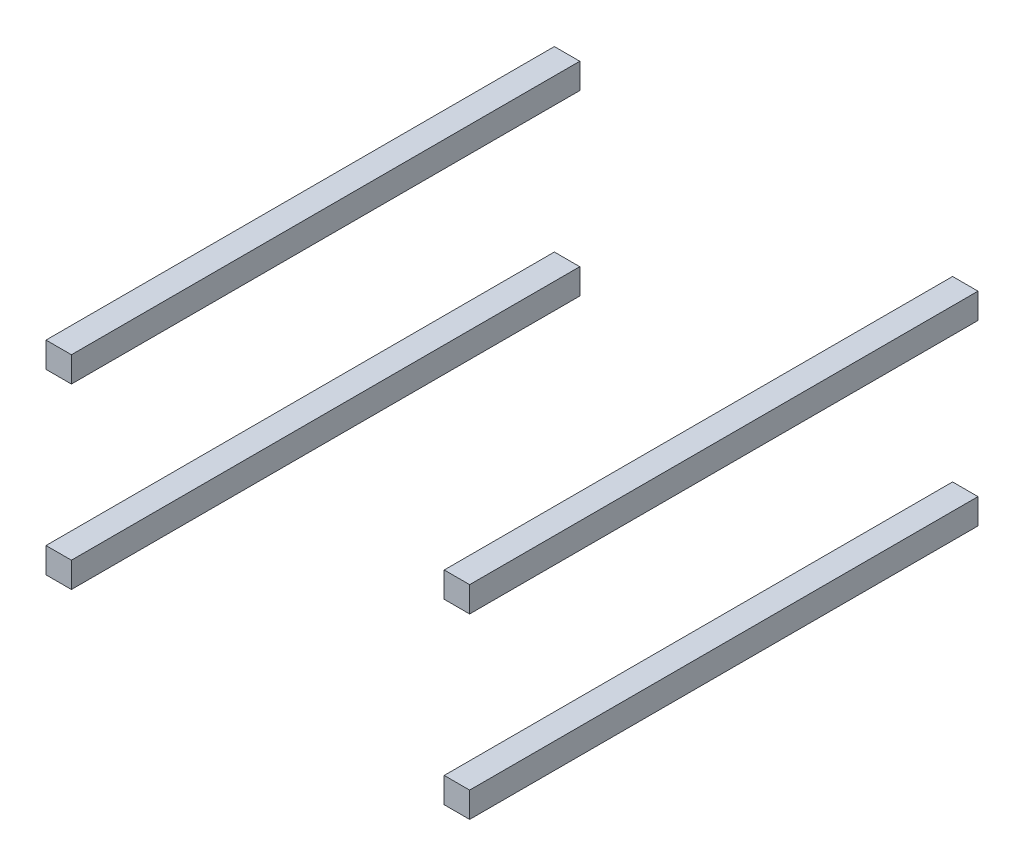
from build123d import *

# Parameters (mm, degrees)
SKETCH_1_W        = 30
SKETCH_1_H        = 30
EXTRUDE_1_DEPTH   = 600
EXTRUDE_1_2_DEPTH = 600
EXTRUDE_1_3_DEPTH = 600
EXTRUDE_1_4_DEPTH = 600


with BuildPart() as part:
    # 草图1 → 凸台-拉伸1 (new body)
    with BuildSketch(Plane.XY):
        with Locations((-432.698412698, 30.58079164)):
            Rectangle(SKETCH_1_W, SKETCH_1_H)
    extrude(amount=EXTRUDE_1_DEPTH)


with BuildPart() as body_2:
    # 草图1 → Extrude 1 2 (new body)
    with BuildSketch(Plane.XY):
        with Locations((37.301587302, 30.58079164)):
            Rectangle(SKETCH_1_W, SKETCH_1_H)
    extrude(amount=EXTRUDE_1_2_DEPTH)


with BuildPart() as body_3:
    # 草图1 → Extrude 1 3 (new body)
    with BuildSketch(Plane.XY):
        with Locations((-432.698412698, -179.41920836)):
            Rectangle(SKETCH_1_W, SKETCH_1_H)
    extrude(amount=EXTRUDE_1_3_DEPTH)


with BuildPart() as body_4:
    # 草图1 → Extrude 1 4 (new body)
    with BuildSketch(Plane.XY):
        with Locations((37.301587302, -179.41920836)):
            Rectangle(SKETCH_1_W, SKETCH_1_H)
    extrude(amount=EXTRUDE_1_4_DEPTH)


solid = Compound([part.part, body_2.part, body_3.part, body_4.part])
